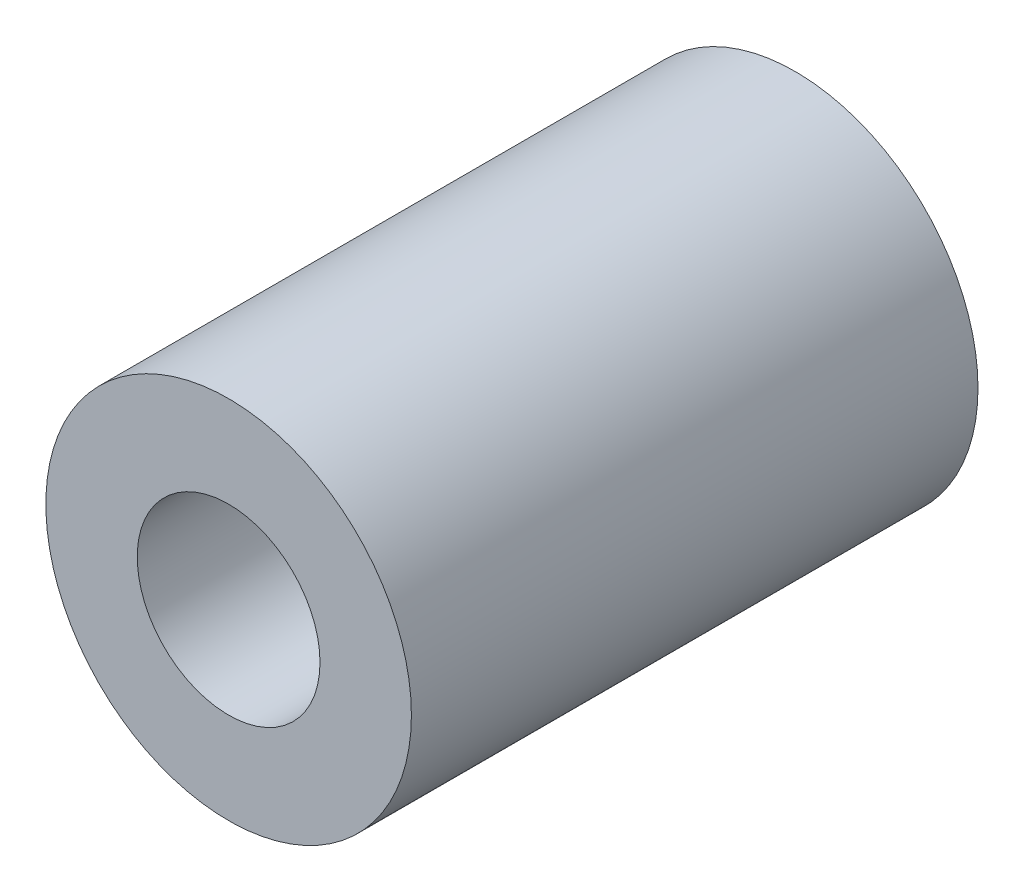
from build123d import *

# Parameters (mm, degrees)
SALIENTE_EXTRUIR5_DEPTH      = 30
SALIENTE_EXTRUIR5_DEPTH_BACK = 1
CROQUIS2_R                   = 10
CROQUIS2_R_2                 = 5


with BuildPart() as part:
    # Croquis2 → Saliente-Extruir5 (new, two sides: drawn at the far end of the back side and taken through both)
    with BuildSketch(Plane.XY.offset(-SALIENTE_EXTRUIR5_DEPTH_BACK)):
        Circle(CROQUIS2_R)
        Circle(CROQUIS2_R_2, mode=Mode.SUBTRACT)
    extrude(amount=SALIENTE_EXTRUIR5_DEPTH + SALIENTE_EXTRUIR5_DEPTH_BACK)


solid = part.part
